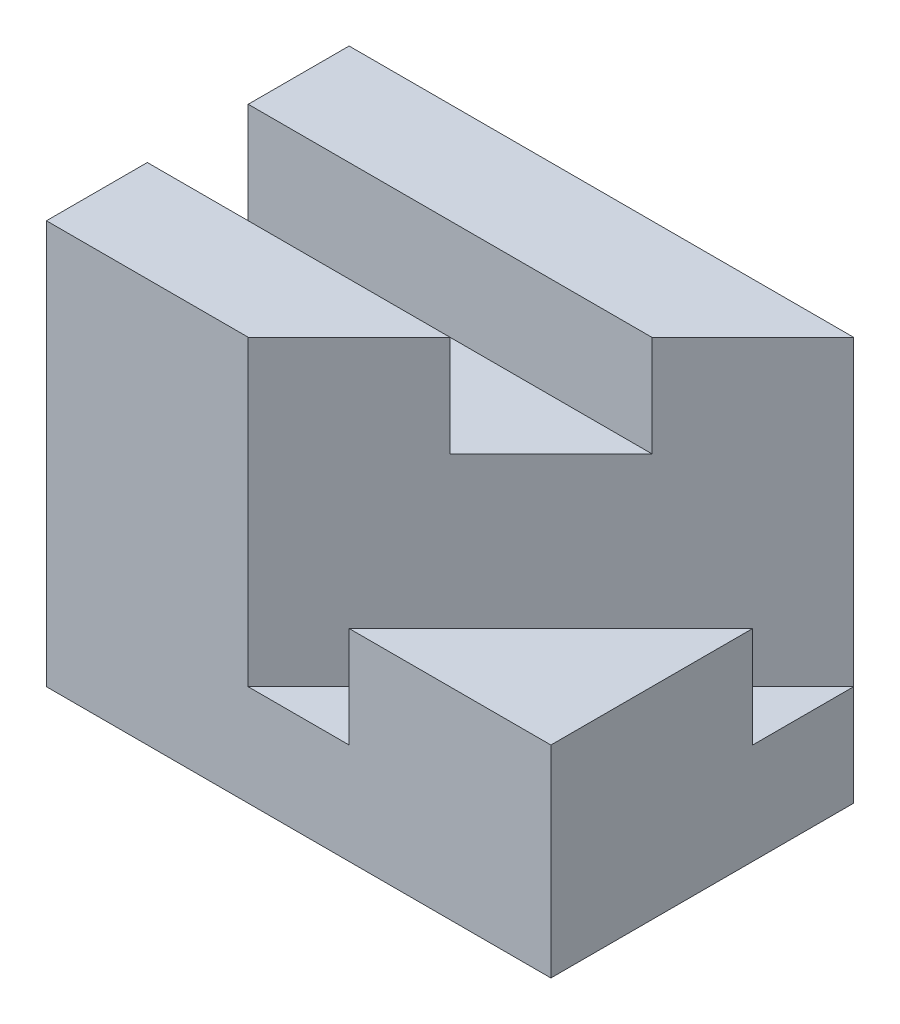
from build123d import *

# Parameters (mm, degrees)
SKETCH1_W               = 50
SKETCH1_H               = 30
BOSS_EXTRUDE1_DEPTH     = 40
CUT_EXTRUDE1_DEPTH      = 10
CUT_EXTRUDE2_DEPTH      = 30
CUT_EXTRUDE3_DEPTH      = 50.497474683
CUT_EXTRUDE3_DEPTH_BACK = 20


with BuildPart() as part:
    # Sketch1 → Boss-Extrude1 (new body)
    with BuildSketch(Plane(origin=(0, 0, 0), x_dir=(1, 0, 0), z_dir=(0, 1, 0))):
        Rectangle(SKETCH1_W, SKETCH1_H)
    extrude(amount=BOSS_EXTRUDE1_DEPTH)

    # Sketch2 → Cut-Extrude1 (cut)
    with BuildSketch(Plane(origin=(0, 40, 0), x_dir=(1, 0, 0), z_dir=(0, 1, 0))):
        Polygon((-25, -5), (5, -5), (15, 5), (-25, 5), align=None)
    extrude(amount=-CUT_EXTRUDE1_DEPTH, mode=Mode.SUBTRACT)

    # Sketch2<3> → Cut-Extrude2 (cut)
    with BuildSketch(Plane(origin=(0, 40, 0), x_dir=(1, 0, 0), z_dir=(0, 1, 0))):
        Polygon((-5, -15), (5, -15), (25, 5), (25, 15), (15, 5), (5, -5), align=None)
    extrude(amount=-CUT_EXTRUDE2_DEPTH, mode=Mode.SUBTRACT)

    # Sketch2<4> → Cut-Extrude3 (cut, two sides: drawn at the far end of the back side and taken through both)
    with BuildSketch(Plane(origin=(0, 40, 0), x_dir=(1, 0, 0), z_dir=(0, 1, 0)).offset(-CUT_EXTRUDE3_DEPTH_BACK)):
        Polygon((5, -15), (25, -15), (25, 5), align=None)
    extrude(amount=CUT_EXTRUDE3_DEPTH + CUT_EXTRUDE3_DEPTH_BACK, mode=Mode.SUBTRACT)


solid = part.part
